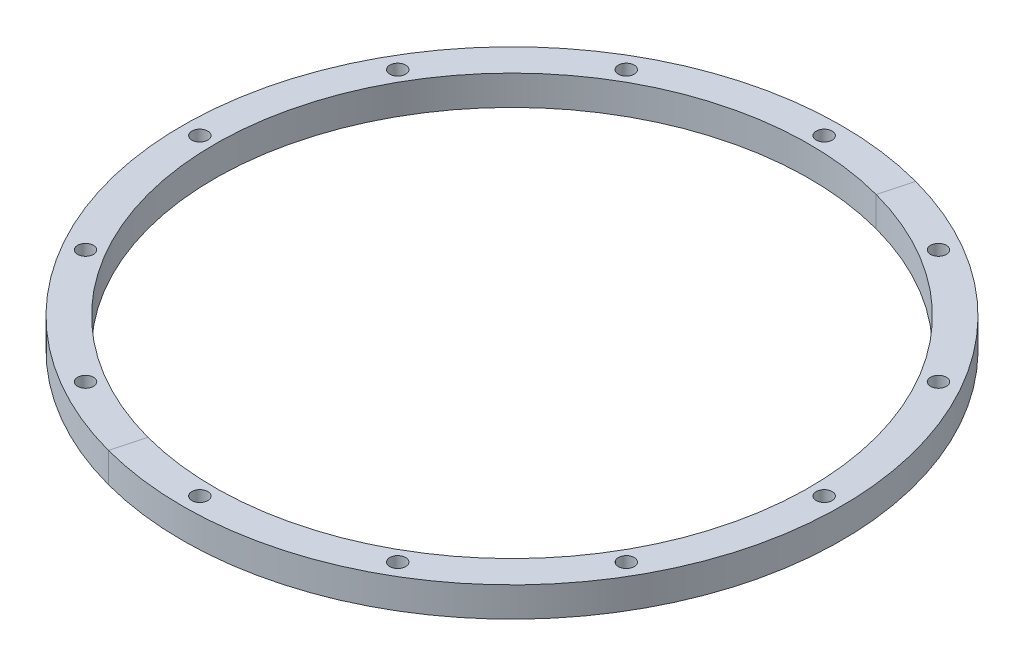
from build123d import *

# Parameters (mm, degrees)
SKETCH1_W          = 6.5
SKETCH1_H          = 6
SKETCH2_R          = 1.6
CUT_EXTRUDE1_DEPTH = 95.236404855
CIRPATTERN1_COUNT  = 12


with BuildPart() as part:
    # Sketch1 → Revolve1 (revolve)
    with BuildSketch(Plane.XY):
        with Locations((-63.25, 3.785)):
            Rectangle(SKETCH1_W, SKETCH1_H)
    revolve(axis=Axis((0, -200069.047495165, 0), (0, 1, 0)))

    # Sketch2 → Cut-Extrude1 (cut, through all)
    with BuildSketch(Plane(origin=(0, 6.785, 0), x_dir=(1, 0, 0), z_dir=(0, 1, 0))):
        with Locations((0, 63)):
            Circle(SKETCH2_R)
    cut_extrude1 = extrude(amount=-CUT_EXTRUDE1_DEPTH, mode=Mode.SUBTRACT)

    # CirPattern1: Cut-Extrude1 ×12 about axis
    cirpattern1_axis = Axis((0, -200069.047495165, 0), (0, -1, 0))
    for i in range(1, CIRPATTERN1_COUNT):
        add(cut_extrude1.rotate(cirpattern1_axis, i * 360 / CIRPATTERN1_COUNT), mode=Mode.SUBTRACT)


with BuildPart() as body_2:
    # Split1: the piece on the far side of the plane
    add(part.part)
    split(bisect_by=Plane(origin=(0, 0, 0), x_dir=(-0.25881904510252135, 0, 0.9659258262890681), z_dir=(0.9659258262890681, 0, 0.25881904510252135)), keep=Keep.BOTTOM)


with BuildPart() as part_1:
    add(part.part)

    # Split1
    split(bisect_by=Plane(origin=(0, 0, 0), x_dir=(-0.25881904510252135, 0, 0.9659258262890681), z_dir=(0.9659258262890681, 0, 0.25881904510252135)), keep=Keep.TOP)


solid = Compound([body_2.part, part_1.part])
